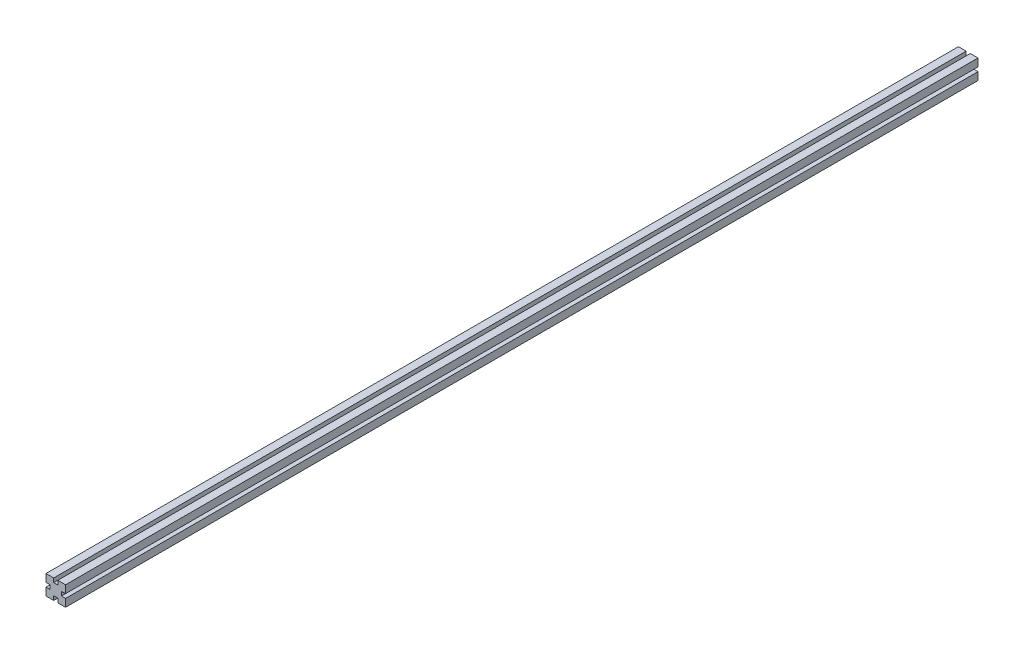
from build123d import *

# Parameters (mm, degrees)
PROFILE_DEPTH = 1778


with BuildPart() as part:
    # Sketch1 → Profile (new body)
    with BuildSketch(Plane.XY):
        Polygon((-19.05, -19.05), (-4, -19.05), (-4, -11.05), (4, -11.05), (4, -19.05), (19.05, -19.05), (19.05, -4), (11.05, -4), (11.05, 4), (19.05, 4), (19.05, 19.05), (4, 19.05), (4, 11.05), (-4, 11.05), (-4, 19.05), (-19.05, 19.05), (-19.05, 4), (-11.05, 4), (-11.05, -4), (-19.05, -4), align=None)
    extrude(amount=PROFILE_DEPTH)


solid = part.part
